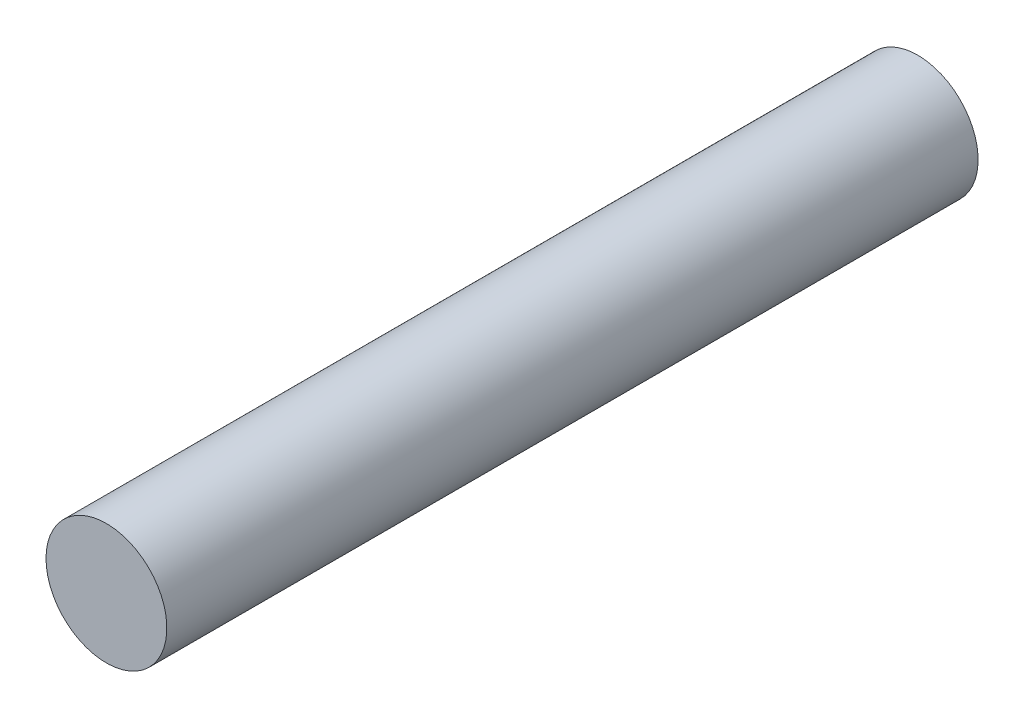
from build123d import *

# Parameters (mm, degrees)
CROQUIS1_R              = 4
SALIENTE_EXTRUIR1_DEPTH = 53.7


with BuildPart() as part:
    # Croquis1 → Saliente-Extruir1 (new body)
    with BuildSketch(Plane.XY):
        with Locations(Location((0, 0, 0), (0, 0, 180))):
            Circle(CROQUIS1_R)
    extrude(amount=SALIENTE_EXTRUIR1_DEPTH)


solid = part.part
